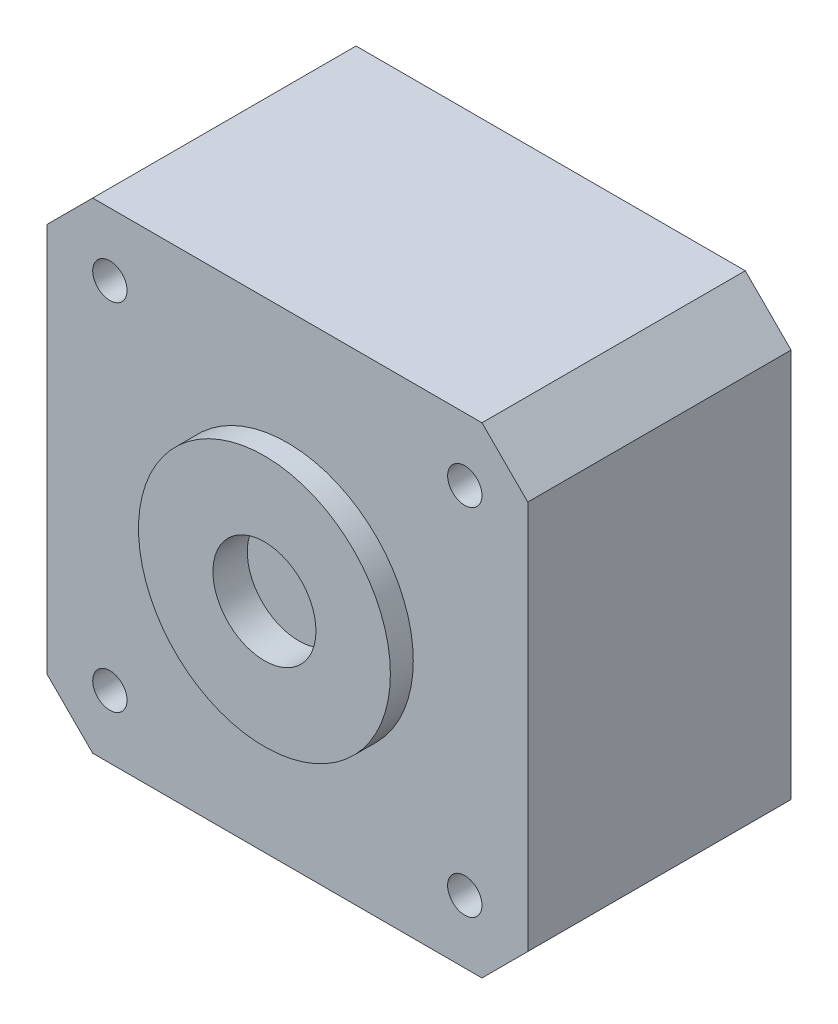
from build123d import *

# Parameters (mm, degrees)
SKETCH_1_R          = 1.5
EXTRUDE_1_DEPTH     = 23
SKETCH_1_3_R        = 1.5
EXTRUDE_2_DEPTH     = 19.5
SKETCH_1_6_R        = 11
EXTRUDE_4_DEPTH     = 25
SKETCH_2_R          = 4.5
CUT_EXTRUDE_1_DEPTH = 3


with BuildPart() as part:
    # 草图1 → 凸台-拉伸1 (new body)
    with BuildSketch(Plane.XY):
        Polygon((-21, -17), (-17, -21), (17, -21), (21, -17), (21, 17), (17, 21), (-17, 21), (-21, 17), align=None)
        with Locations((-15.5, -15.5)):
            Circle(SKETCH_1_R, mode=Mode.SUBTRACT)
        with Locations((15.5, -15.5)):
            Circle(SKETCH_1_R, mode=Mode.SUBTRACT)
        with Locations((-15.5, 15.5)):
            Circle(SKETCH_1_R, mode=Mode.SUBTRACT)
        with Locations((15.5, 15.5)):
            Circle(SKETCH_1_R, mode=Mode.SUBTRACT)
    extrude(amount=EXTRUDE_1_DEPTH)

    # 草图1<3> → 凸台-拉伸2 (add)
    with BuildSketch(Plane.XY):
        with Locations((-15.5, 15.5)):
            Circle(SKETCH_1_3_R)
        with Locations((15.5, 15.5)):
            Circle(SKETCH_1_3_R)
        with Locations((-15.5, -15.5)):
            Circle(SKETCH_1_3_R)
        with Locations((15.5, -15.5)):
            Circle(SKETCH_1_3_R)
    extrude(amount=EXTRUDE_2_DEPTH)

    # 草图1<6> → 凸台-拉伸4 (add)
    with BuildSketch(Plane.XY):
        Circle(SKETCH_1_6_R)
    extrude(amount=EXTRUDE_4_DEPTH)

    # 草图2 → 切除-拉伸1 (cut)
    with BuildSketch(Plane.XY.offset(25)):
        Circle(SKETCH_2_R)
    extrude(amount=-CUT_EXTRUDE_1_DEPTH, mode=Mode.SUBTRACT)


solid = part.part
